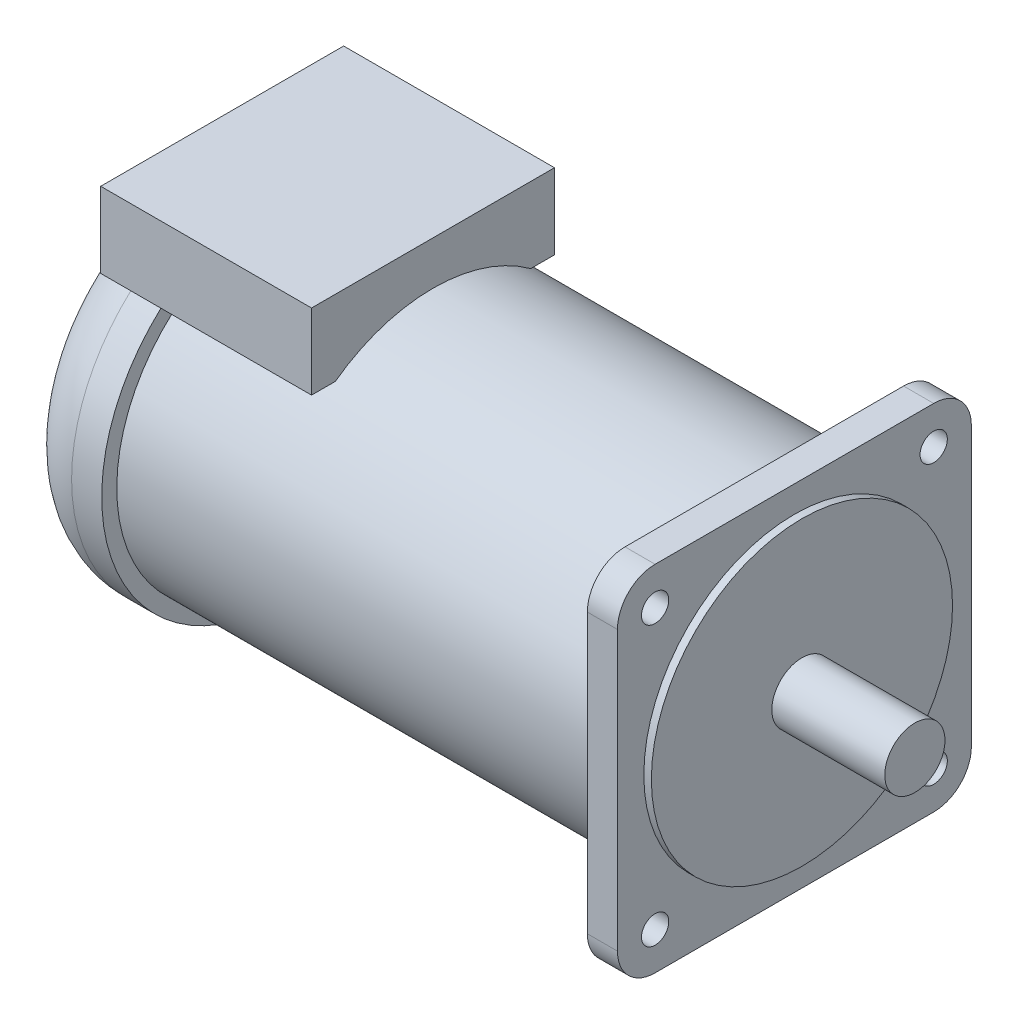
from build123d import *

# Parameters (mm, degrees)
BOSS_EXTRUDE1_DEPTH     = 12.7
SKETCH3_W               = 102.447825146
SKETCH3_H               = 31.827107341
BOSS_EXTRUDE2_DEPTH     = 88.9
SKETCH4_R               = 63.5
PILOT_DIA_DEPTH         = 3.175
F_1_2_20_TAPPED_HOLE2_D = 11.50874
CIRPATTERN2_COUNT       = 4


with BuildPart() as part:
    # Sketch1 → Base-Revolve (revolve)
    with BuildSketch(Plane.XY, mode=Mode.PRIVATE) as base_revolve_sk:
        with BuildLine():
            Line((0, 0), (0, 12.7))
            Line((0, 12.7), (-50.8, 12.7))
            Line((-50.8, 12.7), (-50.8, 69.85))
            Line((-50.8, 69.85), (-266.7, 69.85))
            Line((-266.7, 69.85), (-266.7, 76.2))
            Line((-266.7, 76.2), (-279.4, 76.2))
            ThreePointArc((-279.4, 76.2), (-297.360512242, 68.760512242), (-304.8, 50.8))
            Line((-304.8, 50.8), (-304.8, 0))
            Line((-304.8, 0), (0, 0))
        make_face()
    revolve(base_revolve_sk.sketch.rotate(Axis((0, 0, 0), (1, 0, 0)), 90), axis=Axis((0, 0, 0), (1, 0, 0)))

    # Sketch2 → Boss-Extrude1 (add)
    with BuildSketch(Plane(origin=(-50.8, 0, 0), x_dir=(0, 0, -1), z_dir=(1, 0, 0))):
        with BuildLine():
            Line((74.6125, -58.7375), (74.6125, 58.7375))
            ThreePointArc((74.6125, 58.7375), (69.962820151, 69.962820151), (58.7375, 74.6125))
            Line((58.7375, 74.6125), (-58.7375, 74.6125))
            ThreePointArc((-58.7375, 74.6125), (-69.962820151, 69.962820151), (-74.6125, 58.7375))
            Line((-74.6125, 58.7375), (-74.6125, -58.7375))
            ThreePointArc((-74.6125, -58.7375), (-69.962820151, -69.962820151), (-58.7375, -74.6125))
            Line((-58.7375, -74.6125), (58.7375, -74.6125))
            ThreePointArc((58.7375, -74.6125), (69.962820151, -69.962820151), (74.6125, -58.7375))
        make_face()
    extrude(amount=-BOSS_EXTRUDE1_DEPTH)

    # Sketch3 → Boss-Extrude2 (add)
    with BuildSketch(Plane(origin=(-203.2, 0, 0), x_dir=(0, 0, -1), z_dir=(1, 0, 0))):
        with Locations((0, 72.327654574)):
            Rectangle(SKETCH3_W, SKETCH3_H)
    extrude(amount=-BOSS_EXTRUDE2_DEPTH)

    # Sketch4 → pilot dia (add)
    with BuildSketch(Plane(origin=(-50.8, 0, 0), x_dir=(0, 0, -1), z_dir=(1, 0, 0))):
        with Locations(Location((0, 0, 0), (0, 0, 180))):
            Circle(SKETCH4_R)
    extrude(amount=PILOT_DIA_DEPTH)

    # 1/2-20 Tapped Hole2 (through all)
    with Locations(Plane.ZY.offset(63.5)):
        with Locations((58.7375, 58.7375)):
            f_1_2_20_tapped_hole2 = Hole(F_1_2_20_TAPPED_HOLE2_D / 2)

    # CirPattern2: 1/2-20 Tapped Hole2 ×4 about axis
    cirpattern2_axis = Axis((0, 0, 0), (1, 0, 0))
    for i in range(1, CIRPATTERN2_COUNT):
        add(f_1_2_20_tapped_hole2.rotate(cirpattern2_axis, i * 360 / CIRPATTERN2_COUNT), mode=Mode.SUBTRACT)


solid = part.part
